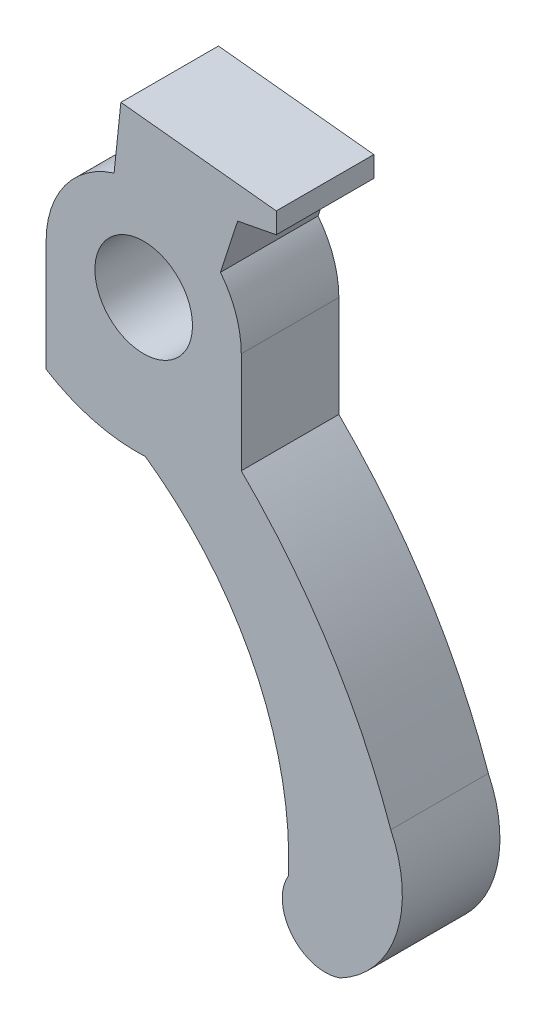
from build123d import *

# Parameters (mm, degrees)
SKETCH_1_R      = 3
EXTRUDE_1_DEPTH = 3
EXTRUDE_2_DEPTH = 3


with BuildPart() as part:
    # 스케치1 → 보스-돌출1 (new, symmetric)
    with BuildSketch(Plane.XY):
        with BuildLine():
            ThreePointArc((-1.820682976, 5.7170896), (-4.843763922, 3.54089693), (-6, 0))
            Line((-6, 0), (-6, -6.821714583))
            ThreePointArc((-6, -6.821714583), (-3.071789079, -8.092559434), (0.10340711, -8.420576201))
            ThreePointArc((0.10340711, -8.420576201), (3.220497082, -7.778565282), (6, -6.22847127))
            Line((6, -6.22847127), (6, 0))
            ThreePointArc((6, 0), (5.671362579, 1.95848066), (4.721451168, 3.702417976))
            Line((4.721451168, 3.702417976), (5.777136763, 6.958366163))
            Line((5.777136763, 6.958366163), (8.152285112, 7.41624395))
            Line((8.152285112, 7.41624395), (8.152285112, 8.689000591))
            Line((8.152285112, 8.689000591), (-1.404354977, 9.690365056))
            Line((-1.404354977, 9.690365056), (-1.820682976, 5.7170896))
        make_face()
        Circle(SKETCH_1_R, mode=Mode.SUBTRACT)
    extrude(amount=EXTRUDE_1_DEPTH, both=True)

    # 스케치1<4> → 보스-돌출2 (add, symmetric)
    with BuildSketch(Plane.XY):
        with BuildLine():
            ThreePointArc((6, -6.22847127), (3.220497082, -7.778565282), (0.10340711, -8.420576201))
            ThreePointArc((0.10340711, -8.420576201), (6.795906325, -16.266900398), (8.894248996, -26.363994395))
            ThreePointArc((8.894248996, -26.363994395), (9.133835845, -29.413676999), (12.091934084, -30.193177258))
            ThreePointArc((12.091934084, -30.193177258), (15.547503566, -26.096056877), (15.192388226, -20.748043324))
            ThreePointArc((15.192388226, -20.748043324), (11.428197085, -12.961513513), (6, -6.22847127))
        make_face()
    extrude(amount=EXTRUDE_2_DEPTH, both=True)


solid = part.part
